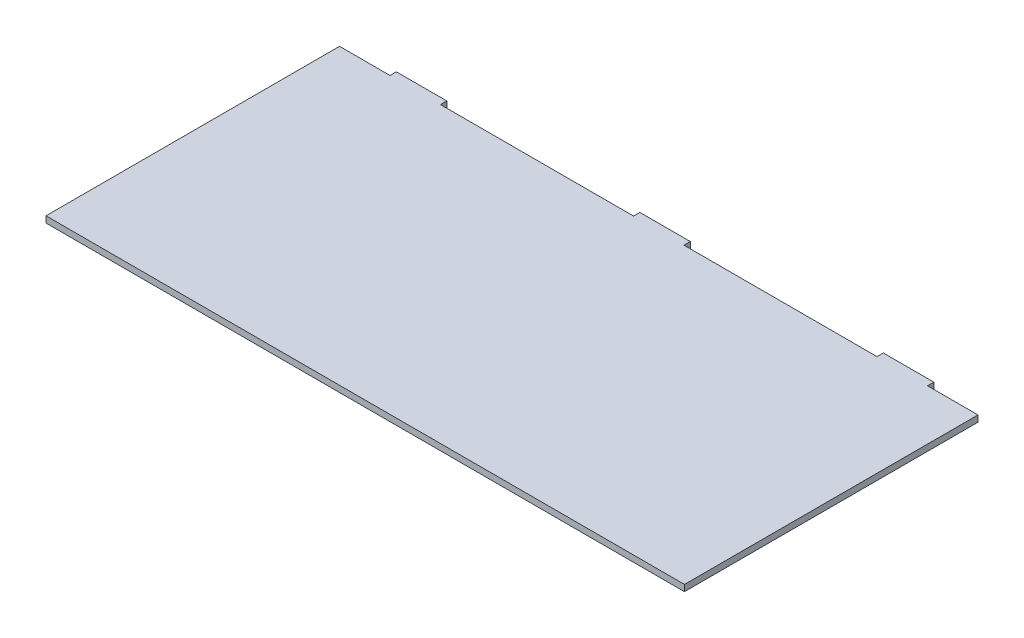
from build123d import *

# Parameters (mm, degrees)
SKETCH1_W           = 321.24142
SKETCH1_H           = 147.69846
BOSS_EXTRUDE1_DEPTH = 3.175
SKETCH2_W           = 25.4
SKETCH2_H           = 3.175
BOSS_EXTRUDE2_DEPTH = 3.175


with BuildPart() as part:
    # Sketch1 → Boss-Extrude1 (new body)
    with BuildSketch(Plane(origin=(0, 0, 0), x_dir=(1, 0, 0), z_dir=(0, 1, 0))):
        with Locations((160.62071, 73.84923)):
            Rectangle(SKETCH1_W, SKETCH1_H)
    extrude(amount=BOSS_EXTRUDE1_DEPTH)

    # Sketch2 → Boss-Extrude2 (add)
    with BuildSketch(Plane(origin=(0, 0, -147.69846), x_dir=(-1, 0, 0), z_dir=(0, 0, -1))):
        with Locations((-283.14142, 1.5875)):
            Rectangle(SKETCH2_W, SKETCH2_H)
        with Locations((-160.62071, 1.5875)):
            Rectangle(SKETCH2_W, SKETCH2_H)
        with Locations((-38.1, 1.5875)):
            Rectangle(SKETCH2_W, SKETCH2_H)
    extrude(amount=BOSS_EXTRUDE2_DEPTH)


solid = part.part
